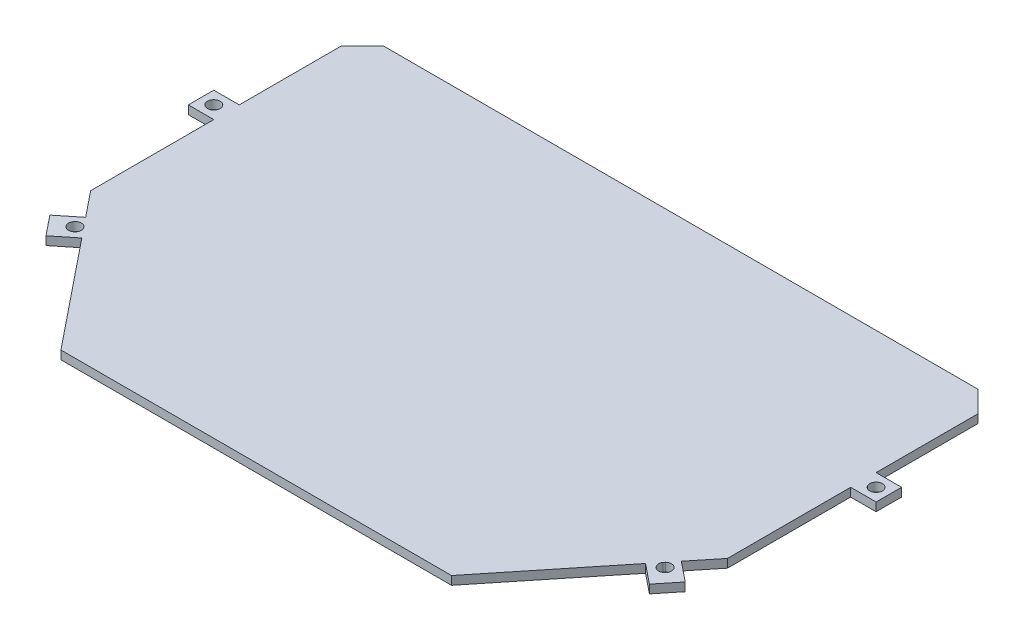
from build123d import *

# Parameters (mm, degrees)
EXTRUDE1_DEPTH = 2
SKETCH3_W      = 6
SKETCH3_H      = 6
SKETCH3_R      = 1.5
EXTRUDE2_DEPTH = 2
CHAMFER2_SIZE  = 5


with BuildPart() as part:
    # Sketch1 → Extrude1 (new body)
    with BuildSketch(Plane(origin=(0, 0, 0), x_dir=(1, 0, 0), z_dir=(0, 1, 0))):
        Polygon((-75, 35), (75, 35), (75, -29), (46, -65), (-46, -65), (-75, -29), align=None)
    extrude(amount=EXTRUDE1_DEPTH)

    # Sketch3 → Extrude2 (add)
    # profile 1 of 2: a face of its own
    with BuildSketch(Plane(origin=(0, 2, 0), x_dir=(1, 0, 0), z_dir=(0, 1, 0))):
        with Locations((78, 3)):
            Rectangle(SKETCH3_W, SKETCH3_H)
        with Locations(Location((78, 3, 0), (0, 0, 270))):
            Circle(SKETCH3_R, mode=Mode.SUBTRACT)
    # profile 2 of 2: a face of its own
    with BuildSketch(Plane(origin=(0, 2, 0), x_dir=(1, 0, 0), z_dir=(0, 1, 0))):
        with BuildLine():
            Line((74.824710663, -38.781951728), (70.152187208, -35.0179745))
            Line((70.152187208, -35.0179745), (68.482047894, -37.09125089))
            ThreePointArc((68.482047894, -37.09125089), (70.09994245, -36.822977113), (70.99646032, -38.19622484))
            ThreePointArc((70.99646032, -38.19622484), (69.104945526, -39.644229041), (68.200838766, -37.440338084))
            Line((68.200838766, -37.440338084), (66.388209981, -39.690497955))
            Line((66.388209981, -39.690497955), (71.060733435, -43.454475182))
            Line((71.060733435, -43.454475182), (74.824710663, -38.781951728))
        make_face()
    extrude2 = extrude(amount=-EXTRUDE2_DEPTH)

    # Chamfer2
    chamfer2_edges = [part.edges().sort_by_distance(p)[0] for p in [
        (-75, 1, -35),
        (75, 1, -35),
    ]]
    chamfer(chamfer2_edges, length=CHAMFER2_SIZE)

    # Mirror1: Extrude2 across plane
    add(extrude2.mirror(Plane(origin=(0, 0, 0), x_dir=(0, 0, 1), z_dir=(1, 0, 0))))


solid = part.part
